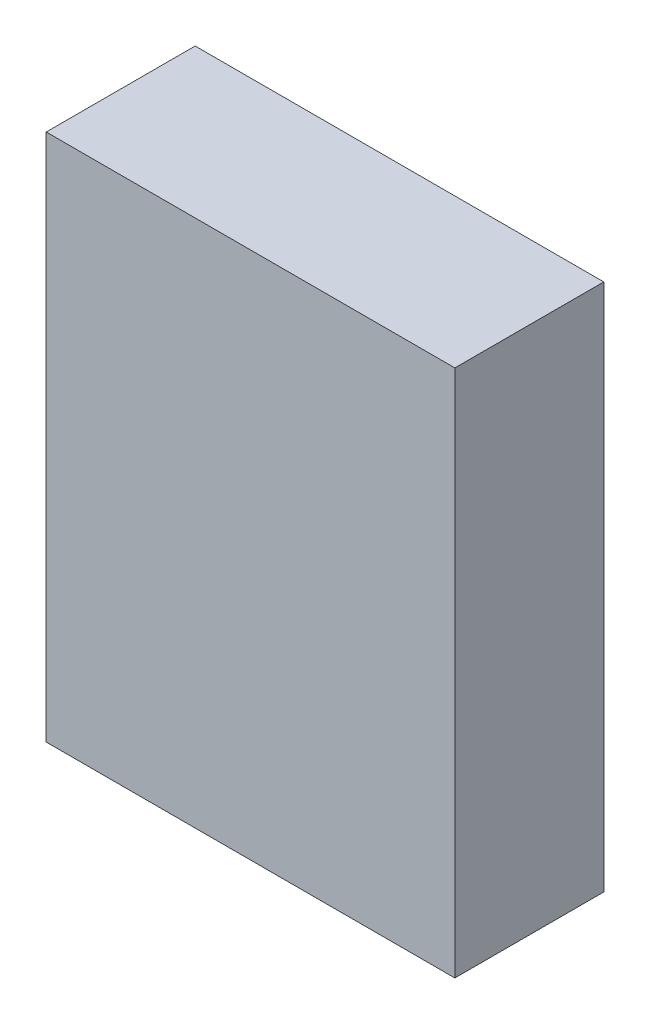
from build123d import *

# Parameters (mm, degrees)
SKETCH1_W           = 28.15
SKETCH1_H           = 36.4
BOSS_EXTRUDE1_DEPTH = 10.26


with BuildPart() as part:
    # Sketch1 → Boss-Extrude1 (new body)
    with BuildSketch(Plane.XY):
        with Locations((-756.790122614, 155.279969002)):
            Rectangle(SKETCH1_W, SKETCH1_H)
    extrude(amount=BOSS_EXTRUDE1_DEPTH)


solid = part.part
